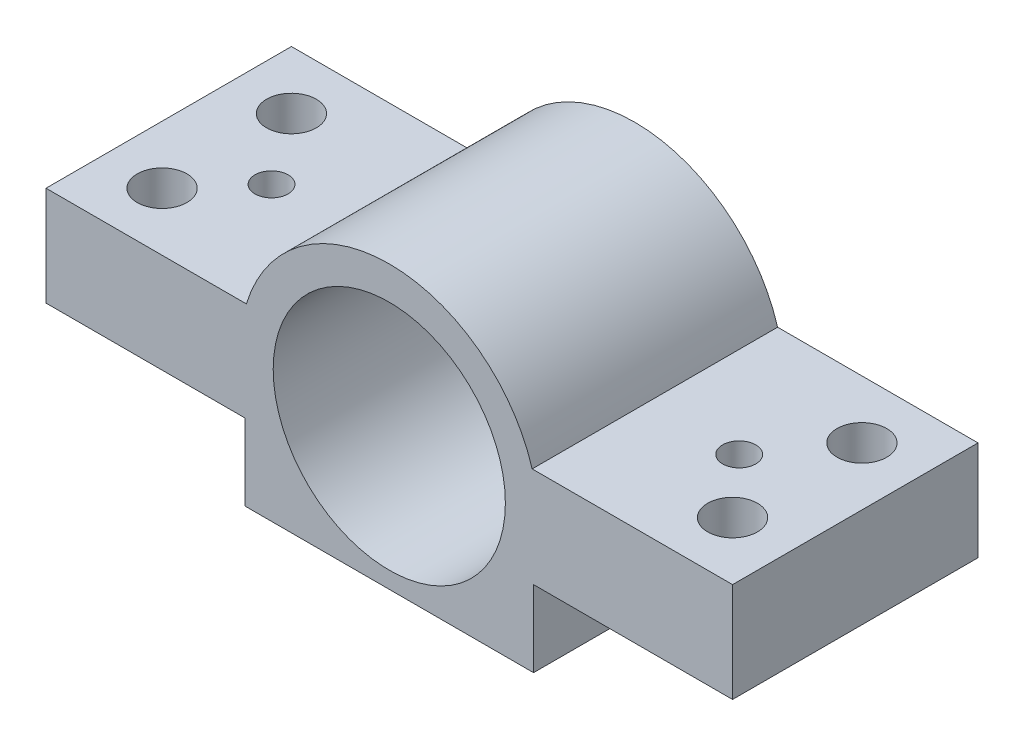
from build123d import *

# Parameters (mm, degrees)
SKETCH_1_R          = 35
EXTRUDE_1_DEPTH     = 74
SKETCH_2_R          = 35
SKETCH_2_R_2        = 21
EXTRUDE_2_DEPTH     = 13
SKETCH_3_R          = 7.5
SKETCH_3_R_2        = 5
CUT_EXTRUDE_1_DEPTH = 30


with BuildPart() as part:
    # 草图1 → 凸台-拉伸1 (new body)
    with BuildSketch(Plane.XY):
        with BuildLine():
            Line((-43.5, 0), (43.5, 0))
            Line((43.5, 0), (43.5, 23))
            Line((43.5, 23), (103.5, 23))
            Line((103.5, 23), (103.5, 53))
            Line((103.5, 53), (43.081318457, 53))
            ThreePointArc((43.081318457, 53), (0, 85), (-43.081318457, 53))
            Line((-43.081318457, 53), (-103.5, 53))
            Line((-103.5, 53), (-103.5, 23))
            Line((-103.5, 23), (-43.5, 23))
            Line((-43.5, 23), (-43.5, 0))
        make_face()
        with Locations((0, 40)):
            Circle(SKETCH_1_R, mode=Mode.SUBTRACT)
    extrude(amount=EXTRUDE_1_DEPTH)

    # 草图2 → 凸台-拉伸2 (add)
    with BuildSketch(Plane(origin=(0, 0, 0), x_dir=(-1, 0, 0), z_dir=(0, 0, -1))):
        with Locations((0, 40)):
            Circle(SKETCH_2_R)
        with Locations((0, 40)):
            Circle(SKETCH_2_R_2, mode=Mode.SUBTRACT)
    extrude(amount=-EXTRUDE_2_DEPTH)

    # 草图3 → 切除-拉伸1 (cut)
    with BuildSketch(Plane.XZ.offset(-23)):
        with Locations(Location((-86, 56.5, 0), (0, 0, 270))):
            Circle(SKETCH_3_R)
        with Locations(Location((-70.5, 39, 0), (0, 0, 270))):
            Circle(SKETCH_3_R_2)
        with Locations(Location((-86, 17.5, 0), (0, 0, 270))):
            Circle(SKETCH_3_R)
        with Locations(Location((86, 56.5, 0), (0, 0, 270))):
            Circle(SKETCH_3_R)
        with Locations(Location((70.5, 39, 0), (0, 0, 270))):
            Circle(SKETCH_3_R_2)
        with Locations(Location((86, 17.5, 0), (0, 0, 270))):
            Circle(SKETCH_3_R)
    extrude(amount=-CUT_EXTRUDE_1_DEPTH, mode=Mode.SUBTRACT)


solid = part.part
